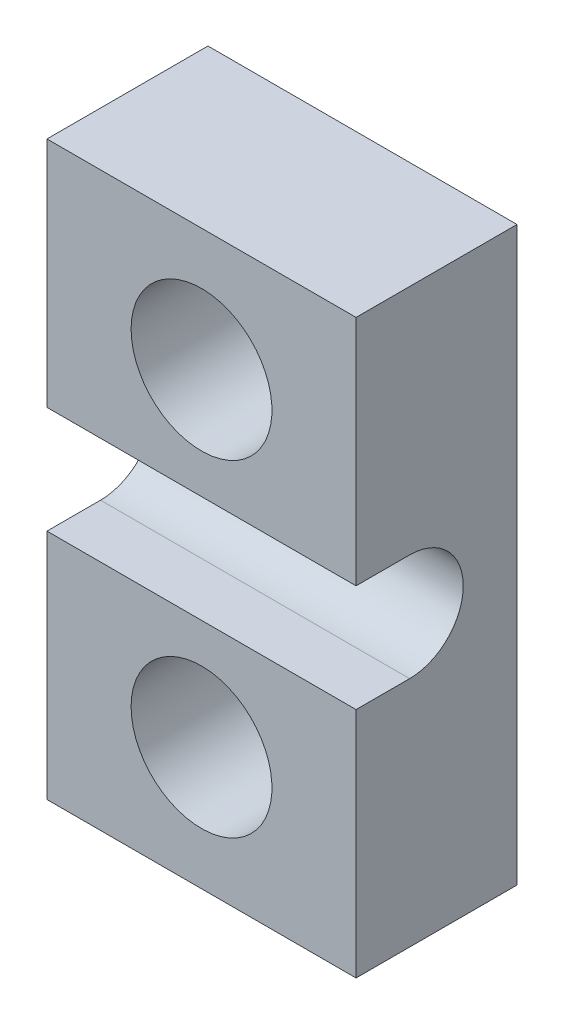
from build123d import *

# Parameters (mm, degrees)
SKETCH1_W           = 6.14482622
SKETCH1_H           = 11.373318705
BOSS_EXTRUDE1_DEPTH = 3.2
SKETCH2_R           = 1.4
CUT_EXTRUDE1_DEPTH  = 261.036225732
CUT_EXTRUDE2_DEPTH  = 145.0912201


with BuildPart() as part:
    # Sketch1 → Boss-Extrude1 (new body)
    with BuildSketch(Plane.XY):
        with Locations((213.478545955, 138.237907074)):
            Rectangle(SKETCH1_W, SKETCH1_H)
    extrude(amount=BOSS_EXTRUDE1_DEPTH)

    # Sketch2 → Cut-Extrude1 (cut, through all)
    with BuildSketch(Plane(origin=(0, 0, 0), x_dir=(-1, 0, 0), z_dir=(0, 0, -1))):
        with Locations((-213.478545955, 141.487907073)):
            Circle(SKETCH2_R)
        with Locations((-213.478545955, 134.987907073)):
            Circle(SKETCH2_R)
    extrude(amount=-CUT_EXTRUDE1_DEPTH, mode=Mode.SUBTRACT)

    # Sketch3 → Cut-Extrude2 (cut, through all)
    with BuildSketch(Plane(origin=(216.550959065, 0, 0), x_dir=(0, 0, -1), z_dir=(1, 0, 0))):
        with BuildLine():
            Line((-2.135, 137.172907073), (-3.2, 137.172907073))
            Line((-3.2, 137.172907073), (-3.2, 139.302907073))
            Line((-3.2, 139.302907073), (-2.135, 139.302907073))
            ThreePointArc((-2.135, 139.302907073), (-1.07, 138.237907073), (-2.135, 137.172907073))
        make_face()
    extrude(amount=-CUT_EXTRUDE2_DEPTH, mode=Mode.SUBTRACT)


solid = part.part
